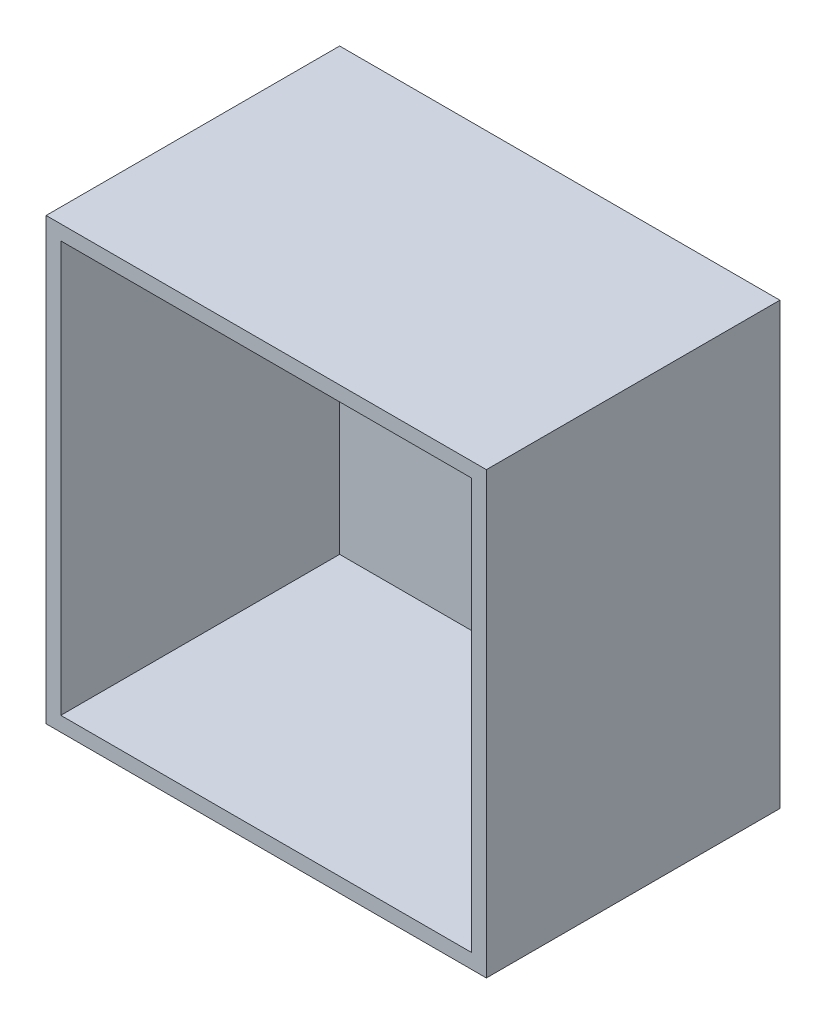
from build123d import *

# Parameters (mm, degrees)
SKETCH2_W           = 76.2
SKETCH2_H           = 76.2
BOSS_EXTRUDE1_DEPTH = 50.8
SHELL1_T            = -2.54


with BuildPart() as part:
    # Sketch2 → Boss-Extrude1 (new body)
    with BuildSketch(Plane.XY):
        with Locations((38.1, 38.1)):
            Rectangle(SKETCH2_W, SKETCH2_H)
    extrude(amount=BOSS_EXTRUDE1_DEPTH)

    # Shell1
    shell1_openings = [part.faces().sort_by_distance(p)[0] for p in [
        (38.1, 38.1, 50.8),
    ]]
    offset(amount=SHELL1_T, openings=shell1_openings, kind=Kind.INTERSECTION)


solid = part.part
